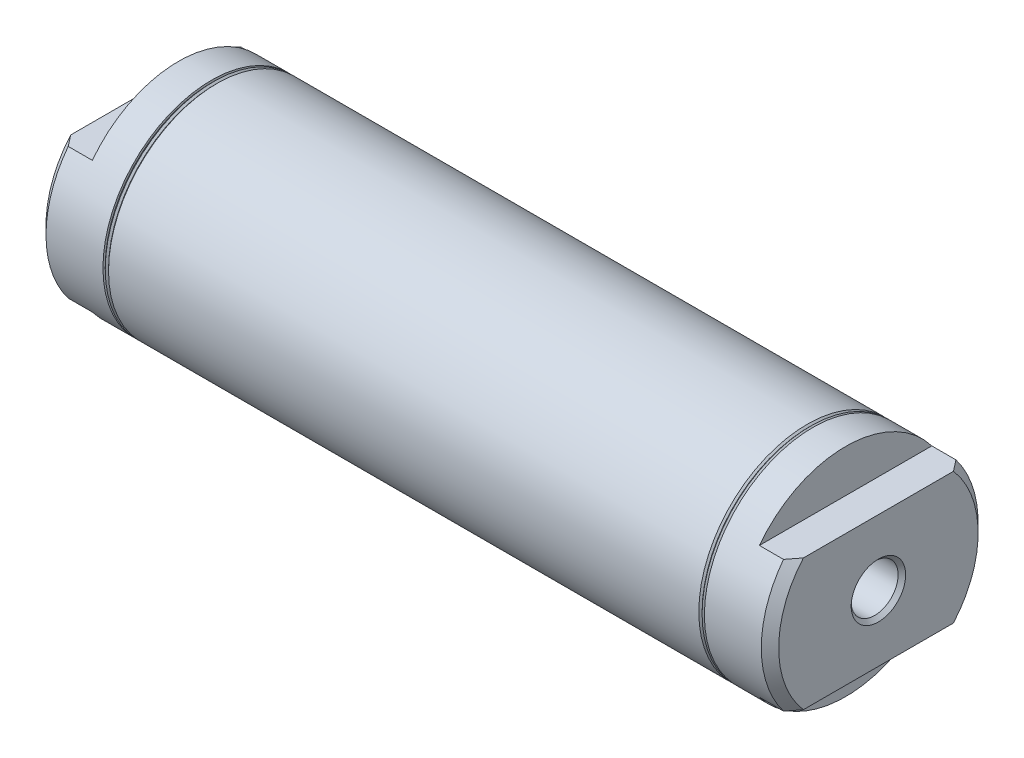
from build123d import *

# Parameters (mm, degrees)
CUT_EXTRUDE1_START        = -7.9248
CUT_EXTRUDE1_DEPTH        = 7.9248
CUT_EXTRUDE2_START        = -7.9248
CUT_EXTRUDE2_DEPTH        = 7.9248
CUT_EXTRUDE3_DEPTH        = 7.9248
CUT_EXTRUDE4_DEPTH        = 7.9248
M10_CLEARANCE_HOLE1_D     = 11.35
M10_CLEARANCE_HOLE1_DEPTH = 9.50976
M10_CLEARANCE_HOLE2_D     = 11.35
M10_CLEARANCE_HOLE2_DEPTH = 9.50976
CHAMFER1_SIZE             = 2.094992
CHAMFER2_SIZE             = 0.9035


with BuildPart() as part:
    # Sketch1 → Revolve1 (revolve)
    with BuildSketch(Plane(origin=(0, 0, 0), x_dir=(-1, 0, 0), z_dir=(0, 0, -1)), mode=Mode.PRIVATE) as revolve1_sk:
        Polygon((-176.9872, 26.1874), (-176.9872, 0), (0, 0), (0, 26.1874), (-15.8496, 26.1874), (-15.8496, 25.632664), (-16.404336, 26.1874), (-16.800576, 25.79116), (-17.196816, 26.1874), (-159.790384, 26.1874), (-160.186624, 25.79116), (-160.582864, 26.1874), (-161.1376, 25.632664), (-161.1376, 26.1874), align=None)
    revolve(revolve1_sk.sketch.rotate(Axis((176.9872, 0, 0), (-1, 0, 0)), 270), axis=Axis((176.9872, 0, 0), (-1, 0, 0)))

    # Sketch2 → Cut-Extrude1 (cut)
    with BuildSketch(Plane.ZY.offset(CUT_EXTRUDE1_START)):
        with BuildLine():
            Line((-20.827008757, 15.875), (20.827008757, 15.875))
            ThreePointArc((20.827008757, 15.875), (0, 26.1874), (-20.827008757, 15.875))
        make_face()
    extrude(amount=CUT_EXTRUDE1_DEPTH, mode=Mode.SUBTRACT)

    # Sketch3 → Cut-Extrude2 (cut)
    with BuildSketch(Plane.ZY.offset(CUT_EXTRUDE2_START)):
        with BuildLine():
            Line((20.827008757, -15.875), (-20.827008757, -15.875))
            ThreePointArc((-20.827008757, -15.875), (0, -26.1874), (20.827008757, -15.875))
        make_face()
    extrude(amount=CUT_EXTRUDE2_DEPTH, mode=Mode.SUBTRACT)

    # Sketch4 → Cut-Extrude3 (cut)
    with BuildSketch(Plane(origin=(176.9872, 0, 0), x_dir=(0, 0, -1), z_dir=(1, 0, 0))):
        with BuildLine():
            Line((-20.827008757, 15.875), (20.827008757, 15.875))
            ThreePointArc((20.827008757, 15.875), (0, 26.1874), (-20.827008757, 15.875))
        make_face()
    extrude(amount=-CUT_EXTRUDE3_DEPTH, mode=Mode.SUBTRACT)

    # Sketch5 → Cut-Extrude4 (cut)
    with BuildSketch(Plane(origin=(176.9872, 0, 0), x_dir=(0, 0, -1), z_dir=(1, 0, 0))):
        with BuildLine():
            Line((20.827008757, -15.875), (-20.827008757, -15.875))
            ThreePointArc((-20.827008757, -15.875), (0, -26.1874), (20.827008757, -15.875))
        make_face()
    extrude(amount=-CUT_EXTRUDE4_DEPTH, mode=Mode.SUBTRACT)

    # M10 Clearance Hole1
    with Locations(Plane(origin=(176.9872, 0, 0), x_dir=(0, 0, -1), z_dir=(1, 0, 0))):
        with Locations((0, 0)):
            Hole(M10_CLEARANCE_HOLE1_D / 2, depth=M10_CLEARANCE_HOLE1_DEPTH)

    # M10 Clearance Hole2
    with Locations(Plane.ZY):
        with Locations((0, 0)):
            Hole(M10_CLEARANCE_HOLE2_D / 2, depth=M10_CLEARANCE_HOLE2_DEPTH)

    # Chamfer1
    chamfer1_edges = [part.edges().sort_by_distance(p)[0] for p in [
        (0, 0, -26.1874),
        (0, 8.377789375, 24.811137901),
        (176.9872, 0, -26.1874),
        (176.9872, 8.377789375, 24.811137901),
    ]]
    chamfer(chamfer1_edges, length=CHAMFER1_SIZE)

    # Chamfer2
    chamfer2_edges = [part.edges().sort_by_distance(p)[0] for p in [
        (176.9872, 0, -5.675),
        (0, 0, 5.675),
    ]]
    chamfer(chamfer2_edges, length=CHAMFER2_SIZE)


solid = part.part
